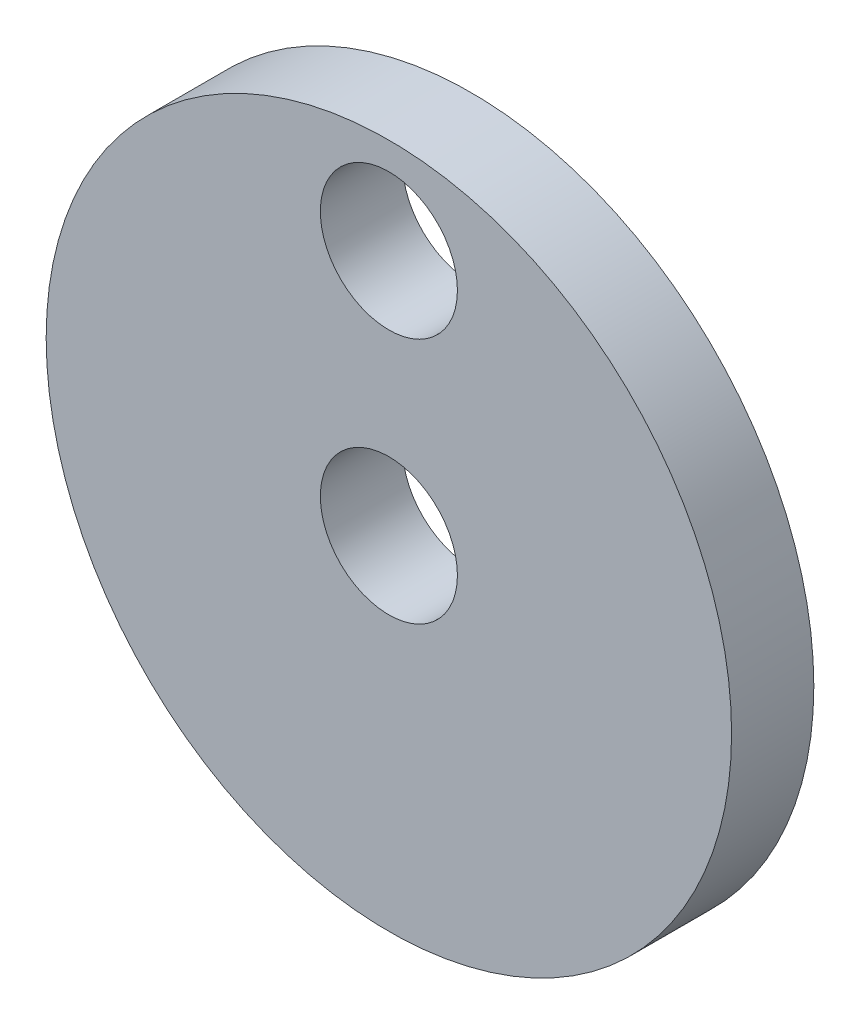
from build123d import *

# Parameters (mm, degrees)
SKETCH_1_R      = 12.5
SKETCH_1_R_2    = 2.5
EXTRUDE_1_DEPTH = 3


with BuildPart() as part:
    # 草圖1 → 填料-伸長1 (new body)
    with BuildSketch(Plane.XY):
        Circle(SKETCH_1_R)
        Circle(SKETCH_1_R_2, mode=Mode.SUBTRACT)
        with Locations((0, 9)):
            Circle(SKETCH_1_R_2, mode=Mode.SUBTRACT)
    extrude(amount=EXTRUDE_1_DEPTH)


solid = part.part
